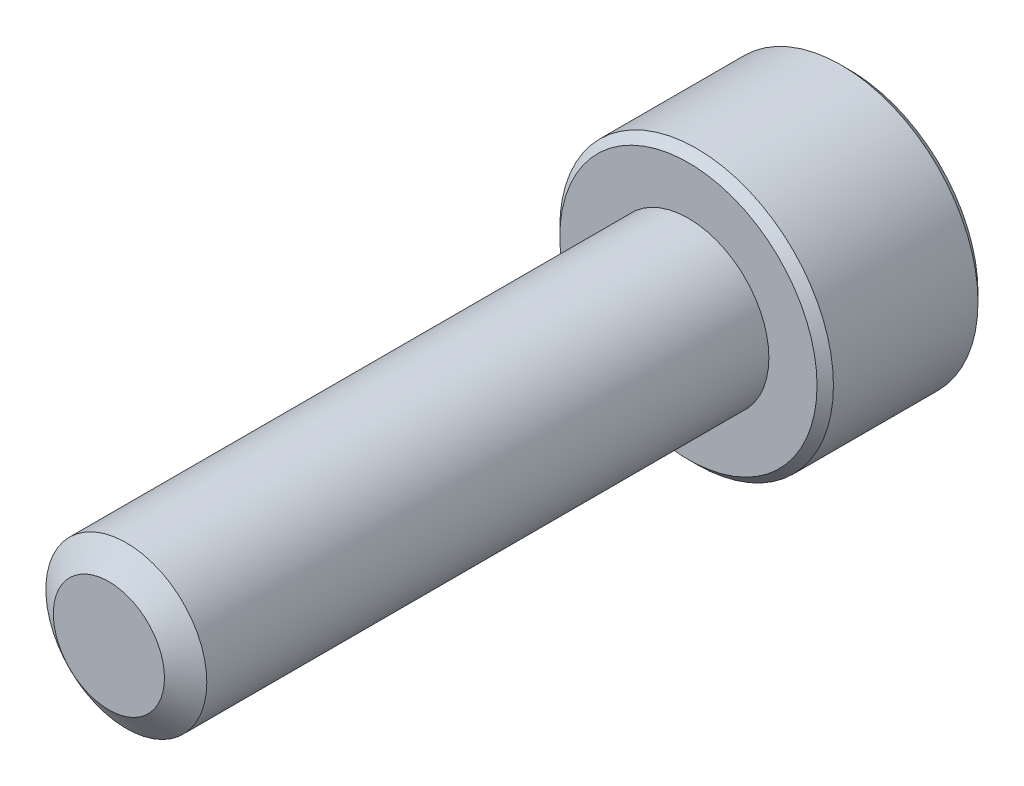
from build123d import *

# Parameters (mm, degrees)
SKETCH1_R          = 2.5
EXTRUDE1_DEPTH     = 18
SKETCH6_R          = 4.25
EXTRUDE2_DEPTH     = 5
CUT_EXTRUDE1_DEPTH = 3
CHAMFER1_SIZE      = 0.255


with BuildPart() as part:
    # Sketch1 → Extrude1 (new body)
    with BuildSketch(Plane.XY):
        Circle(SKETCH1_R)
    extrude(amount=-EXTRUDE1_DEPTH)

    # Sketch4 → Cut-Revolve1 (revolve, cut)
    with BuildSketch(Plane(origin=(0, 0, 0), x_dir=(0, 0, -1), z_dir=(1, 0, 0))):
        Polygon((0.541691224, 2.5), (0, 1.726384758), (0, 2.5), align=None)
    revolve(axis=Axis((0, 0, 0), (0, 0, -1)), mode=Mode.SUBTRACT)

    # Sketch6 → Extrude2 (add)
    with BuildSketch(Plane(origin=(0, 0, -18), x_dir=(-1, 0, 0), z_dir=(0, 0, -1))):
        Circle(SKETCH6_R)
    extrude(amount=EXTRUDE2_DEPTH)

    # Sketch7 → Cut-Extrude1 (cut)
    with BuildSketch(Plane(origin=(0, 0, -23), x_dir=(-1, 0, 0), z_dir=(0, 0, -1))):
        Polygon((0, 2.309401077), (-2, 1.154700538), (-2, -1.154700538), (0, -2.309401077), (2, -1.154700538), (2, 1.154700538), align=None)
    extrude(amount=-CUT_EXTRUDE1_DEPTH, mode=Mode.SUBTRACT)

    # Cut-Extrude2 cone 1 section (through the dimple's axis) → Cut-Extrude2 (revolve, cut)
    with BuildSketch(Plane(origin=(0, 0, -23), x_dir=(0, 1, 0), z_dir=(1, 0, 0))):
        Polygon((0, 0), (2.309401077, 0), (0, 2.309401077), align=None)
    revolve(axis=Axis((0, 0, -23), (0, 0, 1)), mode=Mode.SUBTRACT)

    # Chamfer1
    chamfer1_edges = [part.edges().sort_by_distance(p)[0] for p in [
        (4.25, 0, -23),
        (4.25, 0, -18),
    ]]
    chamfer(chamfer1_edges, length=CHAMFER1_SIZE)

    # Sketch10 → Revolve1 (revolve)
    with BuildSketch(Plane(origin=(0, 0, 0), x_dir=(0, 0, -1), z_dir=(1, 0, 0))):
        Polygon((18, 2.5), (18, 0), (16.764466094, 0), (17.8, 2.5), align=None)
    revolve(axis=Axis((0, 0, -18), (0, 0, 1)))


solid = part.part
